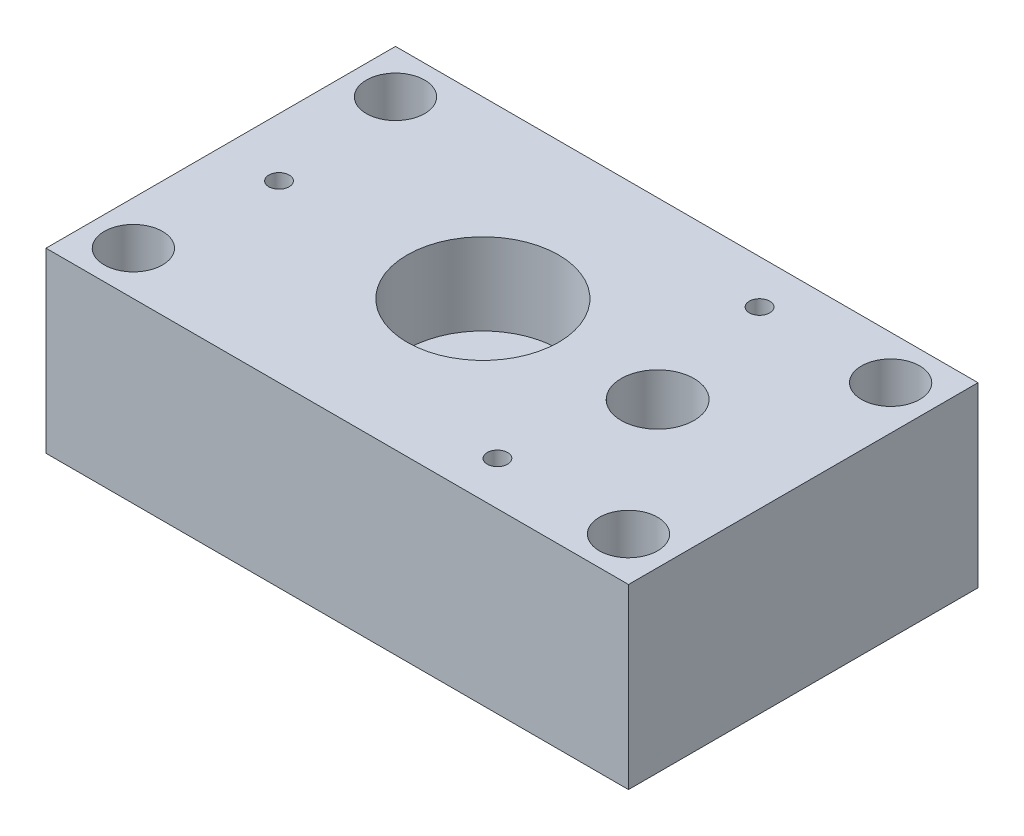
from build123d import *

# Parameters (mm, degrees)
SKETCH_1_W          = 20
SKETCH_1_H          = 12
SKETCH_1_R          = 1.25
SKETCH_1_R_2        = 0.6
SKETCH_1_R_3        = 2.6
EXTRUDE_1_DEPTH     = 2.8
EXTRUDE_START       = 2.8
SKETCH_1_9_W        = 20
SKETCH_1_9_H        = 12
SKETCH_1_9_R        = 1.25
EXTRUDE_2_DEPTH     = 0.5
EXTRUDE_START_2     = 3.3
SKETCH_1_10_W       = 20
SKETCH_1_10_H       = 12
SKETCH_1_10_R       = 1.25
SKETCH_1_10_R_2     = 2.6
EXTRUDE_3_DEPTH     = 2.8
SKETCH_3_R          = 0.75
SKETCH_3_R_2        = 0.35
CUT_EXTRUDE_3_DEPTH = 25.108297327
CUT_EXTRUDE_START   = 6.1
SKETCH_3_4_R        = 1
CUT_EXTRUDE_5_DEPTH = 5.1


with BuildPart() as part:
    # 草图1 → 凸台-拉伸1 (new body)
    with BuildSketch(Plane(origin=(0, 0, 0), x_dir=(1, 0, 0), z_dir=(0, 1, 0))):
        with Locations((10, -6)):
            Rectangle(SKETCH_1_W, SKETCH_1_H)
        with Locations(Location((15, -6, 0), (0, 0, 270))):
            Circle(SKETCH_1_R, mode=Mode.SUBTRACT)
        with Locations(Location((7.678736094, -8.970584613, 0), (0, 0, 270))):
            Circle(SKETCH_1_R_2, mode=Mode.SUBTRACT)
        with Locations(Location((9.847079862, -3.807418404, 0), (0, 0, 270))):
            Circle(SKETCH_1_R_3, mode=Mode.SUBTRACT)
    extrude(amount=EXTRUDE_1_DEPTH)

    # 草图1<9> → 凸台-拉伸2 (add)
    with BuildSketch(Plane(origin=(0, 0, 0), x_dir=(1, 0, 0), z_dir=(0, 1, 0)).offset(EXTRUDE_START)):
        with Locations((10, -6)):
            Rectangle(SKETCH_1_9_W, SKETCH_1_9_H)
        with Locations(Location((15, -6, 0), (0, 0, 270))):
            Circle(SKETCH_1_9_R, mode=Mode.SUBTRACT)
    extrude(amount=EXTRUDE_2_DEPTH)

    # 草图1<10> → 凸台-拉伸3 (add)
    with BuildSketch(Plane(origin=(0, 0, 0), x_dir=(1, 0, 0), z_dir=(0, 1, 0)).offset(EXTRUDE_START_2)):
        with Locations((10, -6)):
            Rectangle(SKETCH_1_10_W, SKETCH_1_10_H)
        with Locations(Location((15, -6, 0), (0, 0, 270))):
            Circle(SKETCH_1_10_R, mode=Mode.SUBTRACT)
        with Locations(Location((9, -6, 0), (0, 0, 270))):
            Circle(SKETCH_1_10_R_2, mode=Mode.SUBTRACT)
    extrude(amount=EXTRUDE_3_DEPTH)

    # 草图3 → 切除-拉伸3 (cut, through all)
    with BuildSketch(Plane(origin=(0, 0, 0), x_dir=(1, 0, 0), z_dir=(0, 1, 0))):
        with Locations(Location((1.5, -1.5, 0), (0, 0, 270))):
            Circle(SKETCH_3_R)
        with Locations(Location((1.5, -10.5, 0), (0, 0, 270))):
            Circle(SKETCH_3_R)
        with Locations(Location((18.5, -10.5, 0), (0, 0, 270))):
            Circle(SKETCH_3_R)
        with Locations(Location((18.5, -1.5, 0), (0, 0, 270))):
            Circle(SKETCH_3_R)
        with Locations(Location((2, -6, 0), (0, 0, 270))):
            Circle(SKETCH_3_R_2)
        with Locations(Location((14, -1.5, 0), (0, 0, 270))):
            Circle(SKETCH_3_R_2)
        with Locations(Location((14, -10.5, 0), (0, 0, 270))):
            Circle(SKETCH_3_R_2)
    extrude(amount=CUT_EXTRUDE_3_DEPTH, mode=Mode.SUBTRACT)

    # 草图3<4> → 切除-拉伸5 (cut)
    with BuildSketch(Plane(origin=(0, 0, 0), x_dir=(1, 0, 0), z_dir=(0, 1, 0)).offset(CUT_EXTRUDE_START)):
        with Locations(Location((1.5, -1.5, 0), (0, 0, 270))):
            Circle(SKETCH_3_4_R)
        with Locations(Location((1.5, -10.5, 0), (0, 0, 270))):
            Circle(SKETCH_3_4_R)
        with Locations(Location((18.5, -1.5, 0), (0, 0, 270))):
            Circle(SKETCH_3_4_R)
        with Locations(Location((18.5, -10.5, 0), (0, 0, 270))):
            Circle(SKETCH_3_4_R)
    extrude(amount=-CUT_EXTRUDE_5_DEPTH, mode=Mode.SUBTRACT)


solid = part.part
